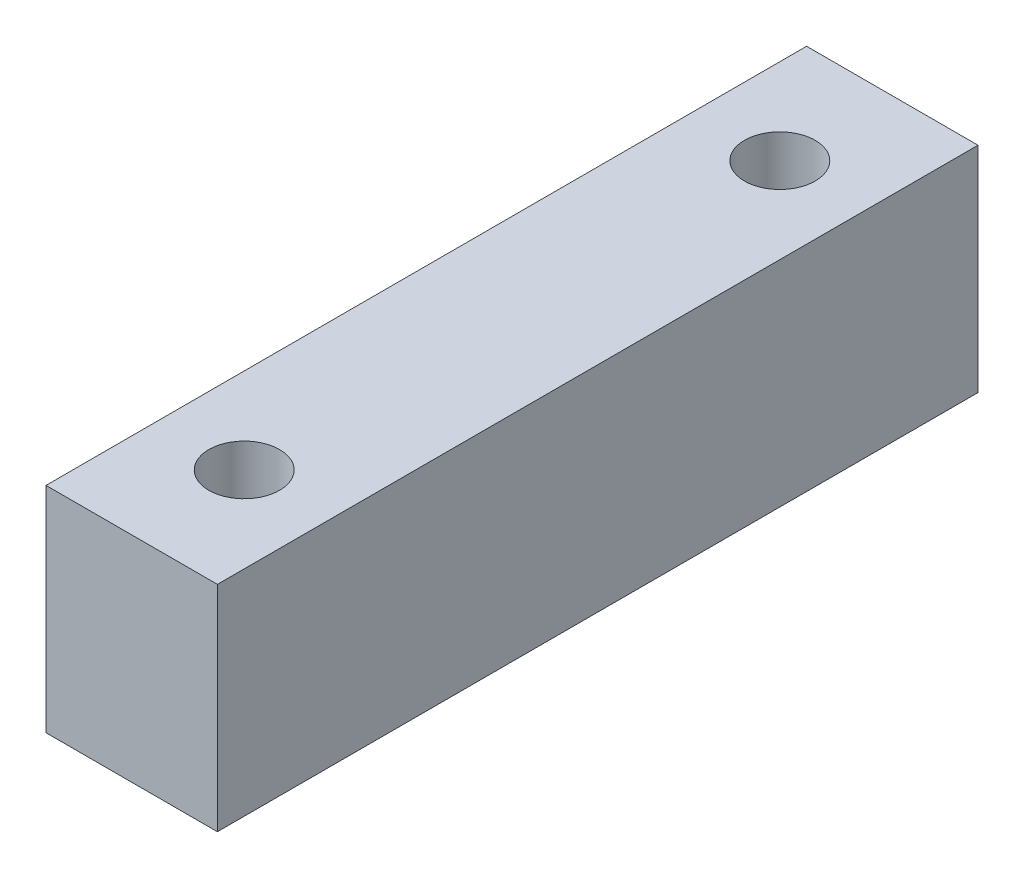
from build123d import *

# Parameters (mm, degrees)
SKETCH_1_W          = 8
SKETCH_1_H          = 35.5
EXTRUDE_1_DEPTH     = 10
CUT_EXTRUDE_1_REACH = 22.762
SKETCH_2_R          = 1.65
SKETCH_3_R          = 3
CUT_EXTRUDE_2_DEPTH = 7


with BuildPart() as part:
    # 草图1 → 凸台-拉伸1 (new body)
    with BuildSketch(Plane(origin=(0, 0, 0), x_dir=(1, 0, 0), z_dir=(0, 1, 0))):
        Rectangle(SKETCH_1_W, SKETCH_1_H)
    extrude(amount=EXTRUDE_1_DEPTH)

    # 草图2 → 切除-拉伸1 (cut, up to next)
    with BuildSketch(Plane(origin=(0, 10, 0), x_dir=(1, 0, 0), z_dir=(0, 1, 0)), mode=Mode.PRIVATE) as cut_extrude_1_sk1:
        with Locations(Location((0, 12.5, 0), (0, 0, 270))):
            Circle(SKETCH_2_R)
    cut_extrude_1_tool1 = extrude(cut_extrude_1_sk1.sketch, amount=-CUT_EXTRUDE_1_REACH, mode=Mode.PRIVATE) & part.part
    # 草图2 → 切除-拉伸1 (cut, up to next)
    with BuildSketch(Plane(origin=(0, 10, 0), x_dir=(1, 0, 0), z_dir=(0, 1, 0)), mode=Mode.PRIVATE) as cut_extrude_1_sk2:
        with Locations(Location((0, -12.5, 0), (0, 0, 270))):
            Circle(SKETCH_2_R)
    cut_extrude_1_tool2 = extrude(cut_extrude_1_sk2.sketch, amount=-CUT_EXTRUDE_1_REACH, mode=Mode.PRIVATE) & part.part
    add(cut_extrude_1_tool1.solids().sort_by_distance((0, 10, -12.5))[0], mode=Mode.SUBTRACT)
    add(cut_extrude_1_tool2.solids().sort_by_distance((0, 10, 12.5))[0], mode=Mode.SUBTRACT)

    # 草图3 → 切除-拉伸2 (cut)
    with BuildSketch(Plane(origin=(0, 0, 0), x_dir=(1, 0, 0), z_dir=(0, 1, 0))):
        with Locations(Location((0, 12.5, 0), (0, 0, 270))):
            Circle(SKETCH_3_R)
        with Locations(Location((0, -12.5, 0), (0, 0, 270))):
            Circle(SKETCH_3_R)
    extrude(amount=CUT_EXTRUDE_2_DEPTH, mode=Mode.SUBTRACT)


solid = part.part
